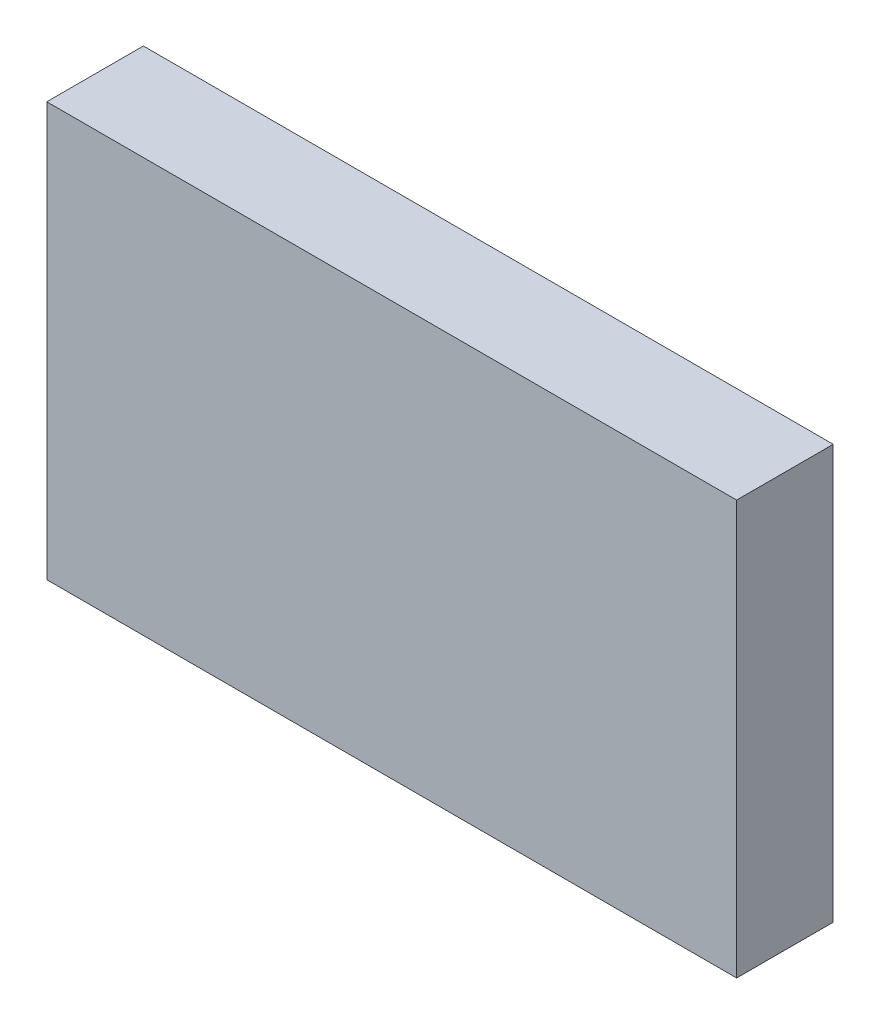
from build123d import *

# Parameters (mm, degrees)
ESQUISSE1_W        = 50
ESQUISSE1_H        = 30
BOSS_EXTRU_1_DEPTH = 3.5


with BuildPart() as part:
    # Esquisse1 → Boss.-Extru.1 (new, symmetric)
    with BuildSketch(Plane.XY):
        Rectangle(ESQUISSE1_W, ESQUISSE1_H)
    extrude(amount=BOSS_EXTRU_1_DEPTH, both=True)


solid = part.part
